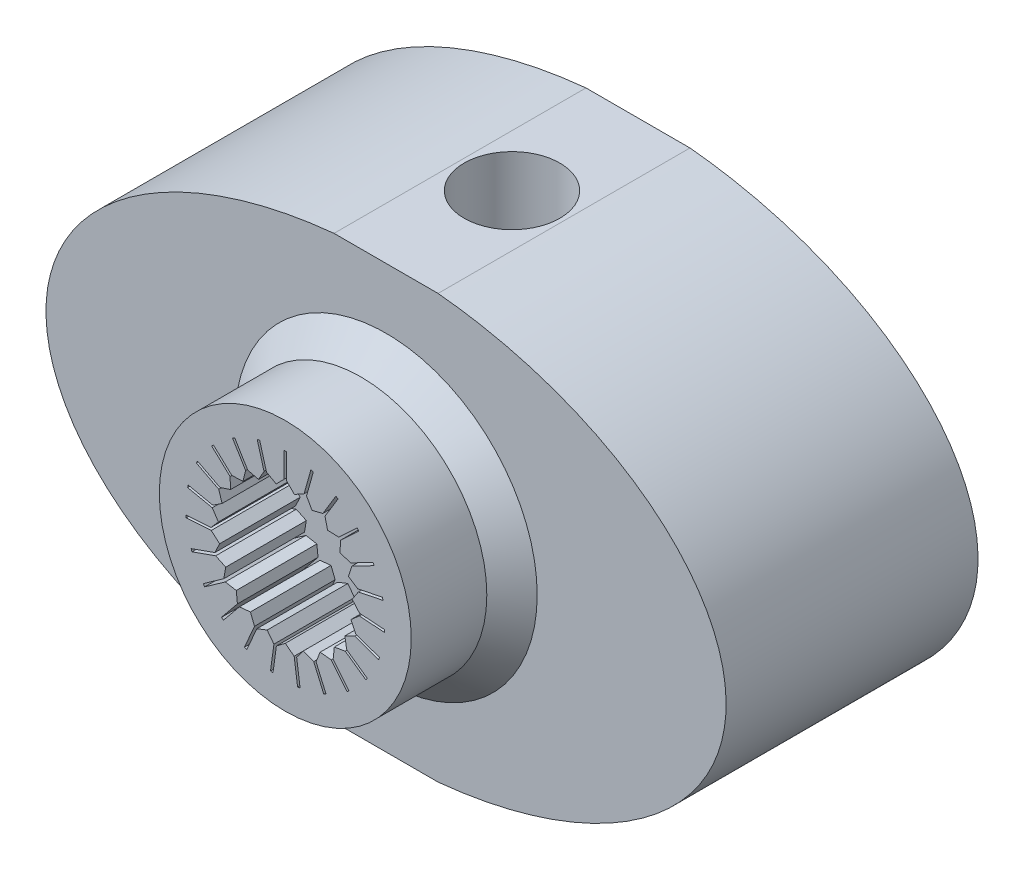
from build123d import *

# Parameters (mm, degrees)
SKETCH_1_RX              = 13.5
SKETCH_1_RY              = 8.5
EXTRUDE_1_DEPTH          = 10
CUT_EXTRUDE_START        = 18.4
SKETCH_2_W               = 5
SKETCH_2_H               = 16.987350845
CUT_EXTRUDE_2_DEPTH      = 10
CUT_EXTRUDE_3_DEPTH      = 24.758998465
CUT_EXTRUDE_3_DEPTH_BACK = 24.758998465
SKETCH_3_R               = 1.9
SKETCH_6_R               = 5
EXTRUDE_3_DEPTH          = 4
CUT_EXTRUDE_5_DEPTH      = 3.2
CHAMFER_1_SIZE           = 1


with BuildPart() as part:
    # ｽｹｯﾁ1 → ﾎﾞｽ - 押し出し1 (new body)
    with BuildSketch(Plane.XY):
        with Locations(Location((0, 0), (0, 0, 180))):
            Ellipse(SKETCH_1_RX, SKETCH_1_RY)
    extrude(amount=EXTRUDE_1_DEPTH)

    # ｽｹｯﾁ2 → ｶｯﾄ - 押し出し2 (cut)
    with BuildSketch(Plane(origin=(0, 0, 0), x_dir=(1, 0, 0), z_dir=(0, 1, 0)).offset(CUT_EXTRUDE_START)):
        with Locations((0, -4.794388707)):
            Rectangle(SKETCH_2_W, SKETCH_2_H)
    cut_extrude_2 = extrude(amount=-CUT_EXTRUDE_2_DEPTH, mode=Mode.SUBTRACT)

    # ﾐﾗｰ1: ｶｯﾄ - 押し出し2 across plane
    add(cut_extrude_2.mirror(Plane.ZX), mode=Mode.SUBTRACT)

    # ｽｹｯﾁ3 → ｶｯﾄ - 押し出し3 (cut, two sides: drawn at the far end of the back side and taken through both)
    with BuildSketch(Plane(origin=(0, 8.4, 0), x_dir=(1, 0, 0), z_dir=(0, 1, 0)).offset(-CUT_EXTRUDE_3_DEPTH_BACK)):
        with Locations(Location((0, -5, 0), (0, 0, 270))):
            Circle(SKETCH_3_R)
    extrude(amount=CUT_EXTRUDE_3_DEPTH + CUT_EXTRUDE_3_DEPTH_BACK, mode=Mode.SUBTRACT)

    # ｽｹｯﾁ6 → ﾎﾞｽ - 押し出し3 (add)
    with BuildSketch(Plane.XY.offset(10)):
        Circle(SKETCH_6_R)
    extrude(amount=EXTRUDE_3_DEPTH)

    # ｽｹｯﾁ5 → ｶｯﾄ - 押し出し5 (cut)
    with BuildSketch(Plane.XY.offset(14)):
        Polygon((-0.05, 2.95), (-0.05, 3.95), (0.05, 3.95), (0.05, 2.95), (0.362514094, 2.637485906), (0.747754611, 2.854095836), (1.017551382, 3.817013124), (1.11384311, 3.790033446), (0.844046339, 2.827116159), (1.060656269, 2.441875642), (1.490051682, 2.546516441), (2.009635632, 3.400935845), (2.095077573, 3.34897745), (1.575493623, 2.494558046), (1.680134421, 2.065162633), (2.121838437, 2.050073571), (2.852674402, 2.732626714), (2.920929716, 2.659543117), (2.190093752, 1.976989974), (2.17500469, 1.535285958), (2.596258142, 1.401586122), (3.484143361, 1.86165116), (3.530149865, 1.772862638), (2.642264646, 1.3127976), (2.50856481, 0.891544148), (2.878125258, 0.649149443), (3.857209346, 0.852605456), (3.877554947, 0.754697047), (2.898470859, 0.551241034), (2.656076155, 0.181680586), (2.94653499, -0.151431681), (3.944203759, -0.219674094), (3.937379518, -0.319440971), (2.939710748, -0.251198558), (2.606598481, -0.541657393), (2.796413701, -0.94078181), (3.738674623, -1.275661422), (3.705186662, -1.369887514), (2.76292574, -1.035007902), (2.363801323, -1.224823122), (2.4388952, -1.660358456), (3.255865093, -2.237038778), (3.198197061, -2.318735767), (2.381227168, -1.742055445), (1.945691834, -1.817149322), (1.900495, -2.25679391), (2.531582945, -3.032505201), (2.454011816, -3.095613995), (1.822923871, -2.319902705), (1.383279283, -2.274705871), (1.22114378, -2.685853285), (1.61954487, -3.603064586), (1.52782374, -3.642904695), (1.12942265, -2.725693394), (0.718275236, -2.563557891), (0.451225912, -2.915715208), (0.587392561, -3.906401154), (0.488323967, -3.920017819), (0.352157318, -2.929331873), (0, -2.66228255), (-0.352157318, -2.929331873), (-0.488323967, -3.920017819), (-0.587392561, -3.906401154), (-0.451225912, -2.915715208), (-0.718275236, -2.563557891), (-1.12942265, -2.725693394), (-1.52782374, -3.642904695), (-1.61954487, -3.603064586), (-1.22114378, -2.685853285), (-1.383279283, -2.274705871), (-1.822923871, -2.319902705), (-2.454011816, -3.095613995), (-2.531582945, -3.032505201), (-1.900495, -2.25679391), (-1.945691834, -1.817149322), (-2.381227168, -1.742055445), (-3.198197061, -2.318735767), (-3.255865093, -2.237038778), (-2.4388952, -1.660358456), (-2.363801323, -1.224823122), (-2.76292574, -1.035007902), (-3.705186662, -1.369887514), (-3.738674623, -1.275661422), (-2.796413701, -0.94078181), (-2.606598481, -0.541657393), (-2.939710748, -0.251198558), (-3.937379518, -0.319440971), (-3.944203759, -0.219674094), (-2.94653499, -0.151431681), (-2.656076155, 0.181680586), (-2.898470859, 0.551241034), (-3.877554947, 0.754697047), (-3.857209346, 0.852605456), (-2.878125258, 0.649149443), (-2.50856481, 0.891544148), (-2.642264646, 1.3127976), (-3.530149865, 1.772862638), (-3.484143361, 1.86165116), (-2.596258142, 1.401586122), (-2.17500469, 1.535285958), (-2.190093752, 1.976989974), (-2.920929716, 2.659543117), (-2.852674402, 2.732626714), (-2.121838437, 2.050073571), (-1.680134421, 2.065162633), (-1.575493623, 2.494558046), (-2.095077573, 3.34897745), (-2.009635632, 3.400935845), (-1.490051682, 2.546516441), (-1.060656269, 2.441875642), (-0.844046339, 2.827116159), (-1.11384311, 3.790033446), (-1.017551382, 3.817013124), (-0.747754611, 2.854095836), (-0.362514094, 2.637485906), align=None)
    extrude(amount=-CUT_EXTRUDE_5_DEPTH, mode=Mode.SUBTRACT)

    # 面取り1
    chamfer_1_edges = [part.edges().sort_by_distance(p)[0] for p in [
        (-5, 0, 10),
    ]]
    chamfer(chamfer_1_edges, length=CHAMFER_1_SIZE)


solid = part.part
